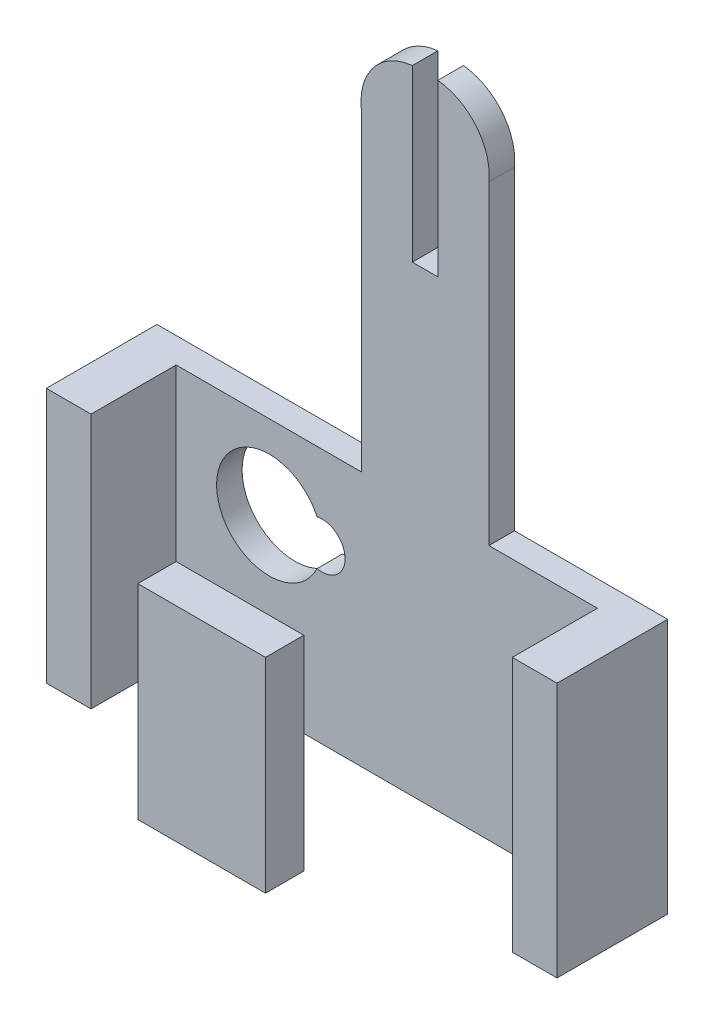
from build123d import *

# Parameters (mm, degrees)
BOSS_EXTRUDE1_DEPTH = 3
SKETCH2_W           = 5.25
SKETCH2_H           = 30
BOSS_EXTRUDE2_DEPTH = 10
BOSS_EXTRUDE3_DEPTH = 4.5


with BuildPart() as part:
    # Sketch1 → Boss-Extrude1 (new body)
    with BuildSketch(Plane.XY):
        with BuildLine():
            Line((1.5, 0), (-1.5, 0))
            Line((-1.5, 0), (-1.5, 20))
            ThreePointArc((-1.5, 20), (-6.020163774, 17.572640687), (-7.5, 12.66))
            Line((-7.5, 12.66), (-7.5, 0))
            Line((-7.5, 0), (-7.5, -24.34))
            Line((-7.5, -24.34), (-34.5, -24.34))
            Line((-34.5, -24.34), (-34.5, -54.34))
            Line((-34.5, -54.34), (25.5, -54.34))
            Line((25.5, -54.34), (25.5, -24.34))
            Line((25.5, -24.34), (7.5, -24.34))
            Line((7.5, -24.34), (7.5, 0))
            Line((7.5, 0), (7.5, 12.66))
            ThreePointArc((7.5, 12.66), (6.020163774, 17.572640687), (1.5, 20))
            Line((1.5, 20), (1.5, 0))
        make_face()
        with BuildLine():
            ThreePointArc((-12.687903226, -31.50478278), (-24.5, -34.14), (-12.687903226, -36.77521722))
            ThreePointArc((-12.687903226, -36.77521722), (-9.4, -34.14), (-12.687903226, -31.50478278))
        make_face(mode=Mode.SUBTRACT)
    extrude(amount=BOSS_EXTRUDE1_DEPTH)

    # Sketch2 → Boss-Extrude2 (add)
    with BuildSketch(Plane.XY.offset(3)):
        with Locations((-31.875, -39.34)):
            Rectangle(SKETCH2_W, SKETCH2_H)
        with Locations((22.875, -39.34)):
            Rectangle(SKETCH2_W, SKETCH2_H)
    extrude(amount=BOSS_EXTRUDE2_DEPTH)

    # Sketch3 → Boss-Extrude3 (add)
    with BuildSketch(Plane.XY.offset(3)):
        Polygon((-29.25, -54.34), (-29.25, -44.34), (-14.25, -44.34), (-14.25, -68.34), (-29.25, -68.34), align=None)
    extrude(amount=BOSS_EXTRUDE3_DEPTH)


solid = part.part
